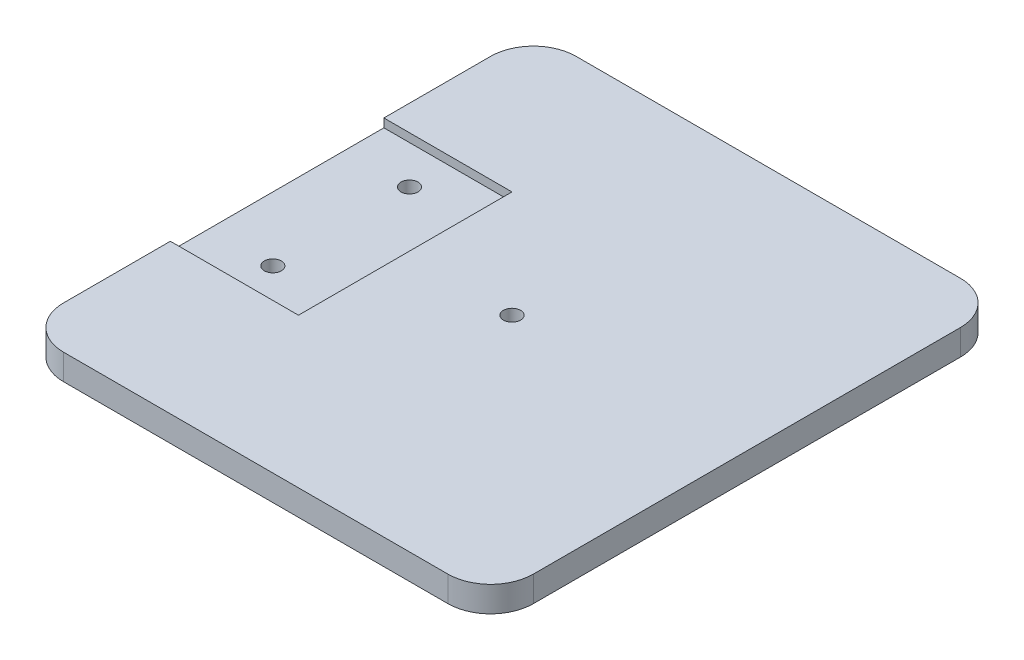
from build123d import *

# Parameters (mm, degrees)
SKETCH2_W           = 55
SKETCH2_H           = 60
BOSS_EXTRUDE1_DEPTH = 3
SKETCH3_W           = 15
SKETCH3_H           = 25
CUT_EXTRUDE1_DEPTH  = 1
SKETCH4_R           = 1
CUT_EXTRUDE3_DEPTH  = 5
FILLET1_R           = 5
SKETCH5_R           = 1
CUT_EXTRUDE4_DEPTH  = 5


with BuildPart() as part:
    # Sketch2 → Boss-Extrude1 (new body)
    with BuildSketch(Plane(origin=(0, 0, 0), x_dir=(1, 0, 0), z_dir=(0, 1, 0))):
        with Locations((-50.625, -5.625)):
            Rectangle(SKETCH2_W, SKETCH2_H)
    extrude(amount=BOSS_EXTRUDE1_DEPTH)

    # Sketch3 → Cut-Extrude1 (cut)
    with BuildSketch(Plane(origin=(0, 3, 0), x_dir=(1, 0, 0), z_dir=(0, 1, 0))):
        with Locations((-70.625, -5.625)):
            Rectangle(SKETCH3_W, SKETCH3_H)
    extrude(amount=-CUT_EXTRUDE1_DEPTH, mode=Mode.SUBTRACT)

    # Sketch4 → Cut-Extrude3 (cut)
    with BuildSketch(Plane(origin=(0, 3, 0), x_dir=(1, 0, 0), z_dir=(0, 1, 0))):
        with Locations(Location((-70.625, 2.375, 0), (0, 0, 270))):
            Circle(SKETCH4_R)
        with Locations(Location((-70.625, -13.625, 0), (0, 0, 270))):
            Circle(SKETCH4_R)
    extrude(amount=-CUT_EXTRUDE3_DEPTH, mode=Mode.SUBTRACT)

    # Fillet1
    fillet1_edges = [part.edges().sort_by_distance(p)[0] for p in [
        (-78.125, 1.5, -24.375),
        (-23.125, 1.5, -24.375),
        (-23.125, 1.5, 35.625),
        (-78.125, 1.5, 35.625),
    ]]
    fillet(fillet1_edges, radius=FILLET1_R)

    # Sketch5 → Cut-Extrude4 (cut)
    with BuildSketch(Plane(origin=(0, 3, 0), x_dir=(1, 0, 0), z_dir=(0, 1, 0))):
        with Locations(Location((-50.625, -5.625, 0), (0, 0, 270))):
            Circle(SKETCH5_R)
    extrude(amount=-CUT_EXTRUDE4_DEPTH, mode=Mode.SUBTRACT)


solid = part.part
